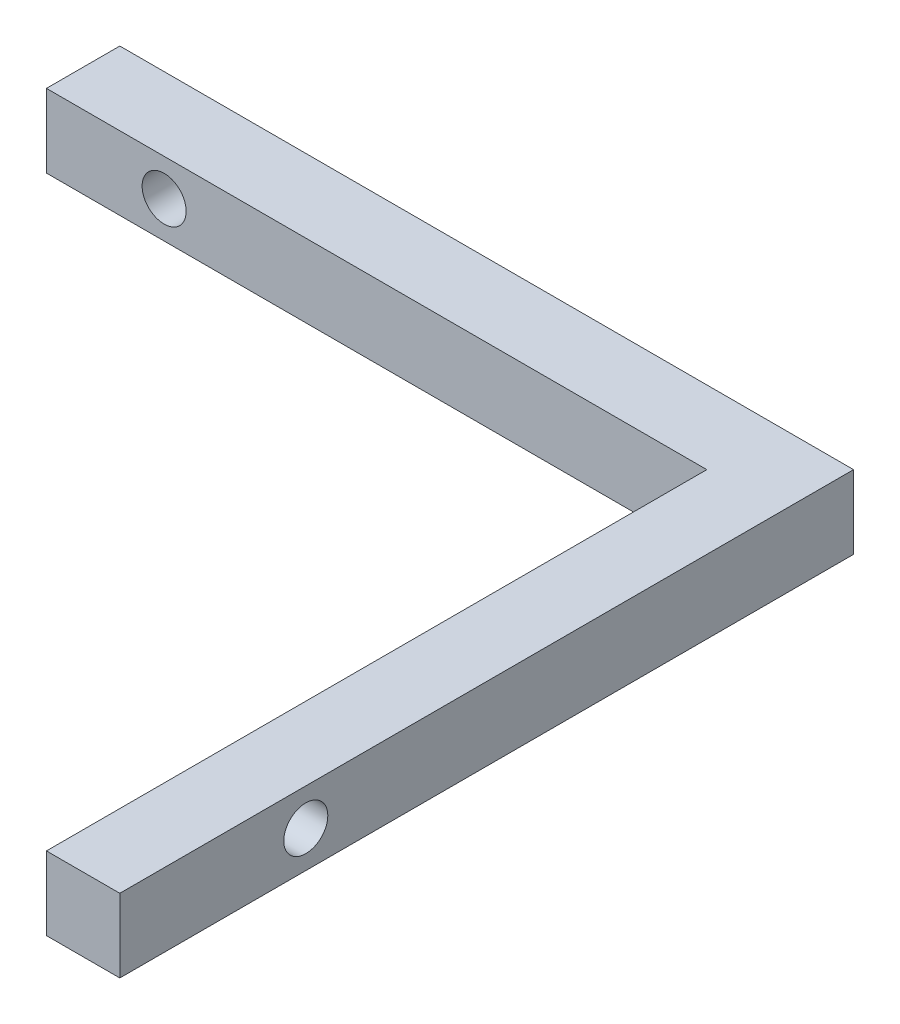
from build123d import *

# Parameters (mm, degrees)
Y_KSEKLIK_EKSTR_ZYON1_DEPTH = 10
IZIM2_R                     = 3
KES_EKSTR_ZYON1_DEPTH       = 113.249721603
IZIM3_R                     = 3
KES_EKSTR_ZYON2_DEPTH       = 139.293166859


with BuildPart() as part:
    # Çizim1 → Yükseklik-Ekstrüzyon1 (new body)
    with BuildSketch(Plane(origin=(0, 0, 0), x_dir=(1, 0, 0), z_dir=(0, 1, 0))):
        Polygon((-50, -5), (40, -5), (40, -95), (50, -95), (50, -10), (50, 5), (18.191830665, 5), (-50, 5), align=None)
    extrude(amount=Y_KSEKLIK_EKSTR_ZYON1_DEPTH)

    # Çizim2 → Kes-Ekstrüzyon1 (cut, through all)
    with BuildSketch(Plane(origin=(0, 0, -5), x_dir=(-1, 0, 0), z_dir=(0, 0, -1))):
        with Locations((33.959177931, 5)):
            Circle(IZIM2_R)
    extrude(amount=-KES_EKSTR_ZYON1_DEPTH, mode=Mode.SUBTRACT)

    # Çizim3 → Kes-Ekstrüzyon2 (cut, through all)
    with BuildSketch(Plane(origin=(50, 0, 0), x_dir=(0, 0, -1), z_dir=(1, 0, 0))):
        with Locations((-69.652523483, 5)):
            Circle(IZIM3_R)
    extrude(amount=-KES_EKSTR_ZYON2_DEPTH, mode=Mode.SUBTRACT)


solid = part.part
